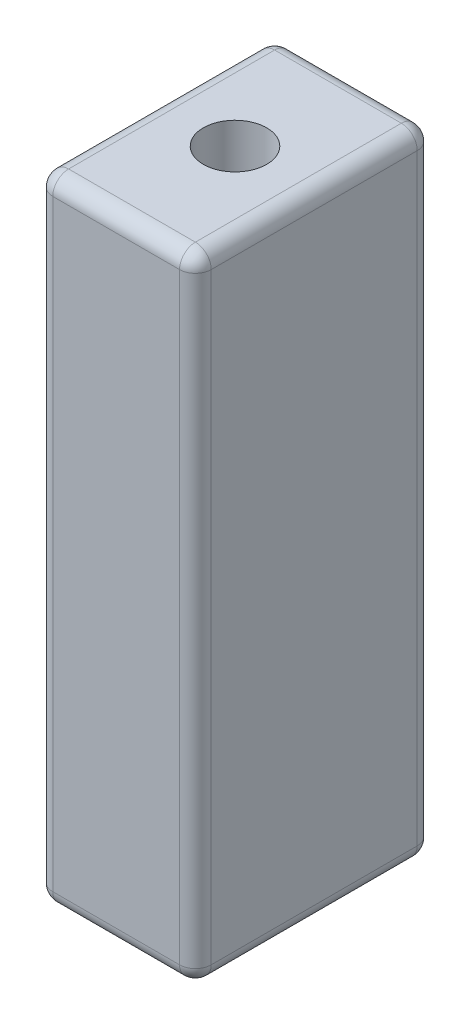
from build123d import *

# Parameters (mm, degrees)
SKETCH1_W           = 20
SKETCH1_H           = 80
BOSS_EXTRUDE1_DEPTH = 30
FILLET1_R           = 2
SKETCH2_R           = 4
CUT_EXTRUDE1_DEPTH  = 10
CUT_EXTRUDE2_START  = -10
SKETCH3_R           = 4
CUT_EXTRUDE2_DEPTH  = 10


with BuildPart() as part:
    # Sketch1 → Boss-Extrude1 (new body)
    with BuildSketch(Plane.XY):
        with Locations((10, 40)):
            Rectangle(SKETCH1_W, SKETCH1_H)
    extrude(amount=BOSS_EXTRUDE1_DEPTH)

    # Fillet1
    fillet1_edges = [part.edges().sort_by_distance(p)[0] for p in [
        (10, 80, 30),
        (20, 40, 30),
        (10, 0, 30),
        (20, 40, 0),
        (10, 80, 0),
        (0, 40, 0),
        (10, 0, 0),
        (20, 0, 15),
        (20, 80, 15),
        (0, 80, 15),
        (0, 0, 15),
        (0, 40, 30),
    ]]
    fillet(fillet1_edges, radius=FILLET1_R)

    # Sketch2 → Cut-Extrude1 (cut)
    with BuildSketch(Plane(origin=(0, 80, 0), x_dir=(1, 0, 0), z_dir=(0, 1, 0))):
        with Locations(Location((10, -15, 0), (0, 0, 270))):
            Circle(SKETCH2_R)
    extrude(amount=-CUT_EXTRUDE1_DEPTH, mode=Mode.SUBTRACT)

    # Sketch3 → Cut-Extrude2 (cut)
    with BuildSketch(Plane.XZ.offset(CUT_EXTRUDE2_START)):
        with Locations(Location((10, 15, 0), (0, 0, 90))):
            Circle(SKETCH3_R)
    extrude(amount=CUT_EXTRUDE2_DEPTH, mode=Mode.SUBTRACT)


solid = part.part
